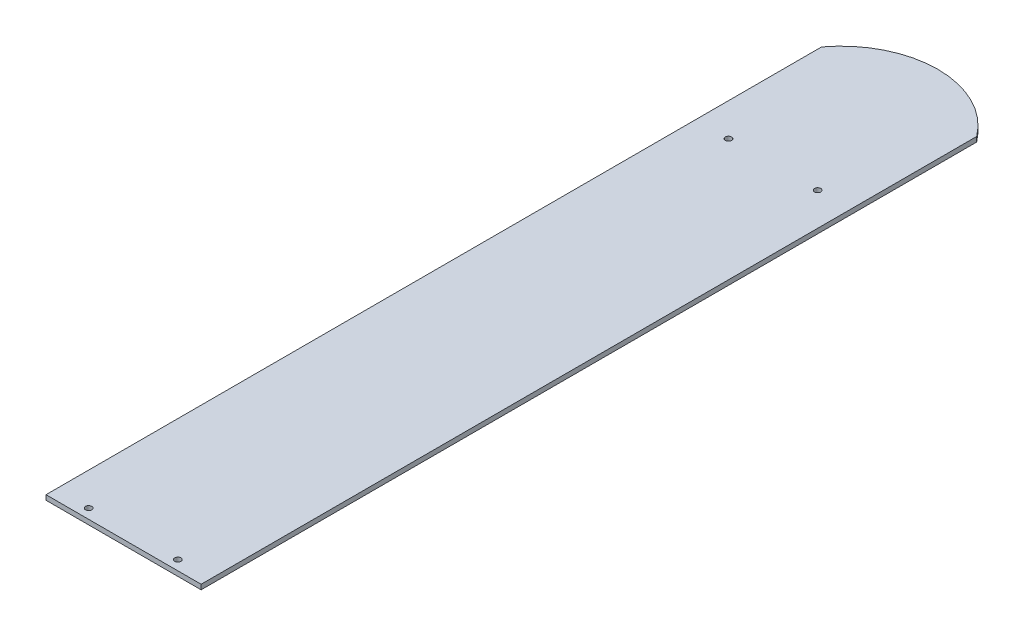
from build123d import *

# Parameters (mm, degrees)
BOSS_EXTRUDE1_DEPTH = 3.175
SKETCH2_R           = 2.032
CUT_EXTRUDE1_DEPTH  = 519.070111689


with BuildPart() as part:
    # Sketch1 → Boss-Extrude1 (new body)
    with BuildSketch(Plane(origin=(0, 0, 0), x_dir=(1, 0, 0), z_dir=(0, 1, 0))):
        with BuildLine():
            Line((0, 0), (0, -508))
            Line((0, -508), (101.6, -508))
            Line((101.6, -508), (101.6, 0))
            ThreePointArc((101.6, 0), (50.8, 25.4), (0, 0))
        make_face()
    extrude(amount=BOSS_EXTRUDE1_DEPTH)

    # Sketch2 → Cut-Extrude1 (cut, through all)
    with BuildSketch(Plane.XZ):
        with Locations(Location((21.59, 501.65, 0), (0, 0, 270))):
            Circle(SKETCH2_R)
        with Locations(Location((80.01, 501.65, 0), (0, 0, 270))):
            Circle(SKETCH2_R)
        with Locations(Location((21.59, 82.55, 0), (0, 0, 270))):
            Circle(SKETCH2_R)
        with Locations(Location((80.01, 82.55, 0), (0, 0, 270))):
            Circle(SKETCH2_R)
    extrude(amount=-CUT_EXTRUDE1_DEPTH, mode=Mode.SUBTRACT)


solid = part.part
